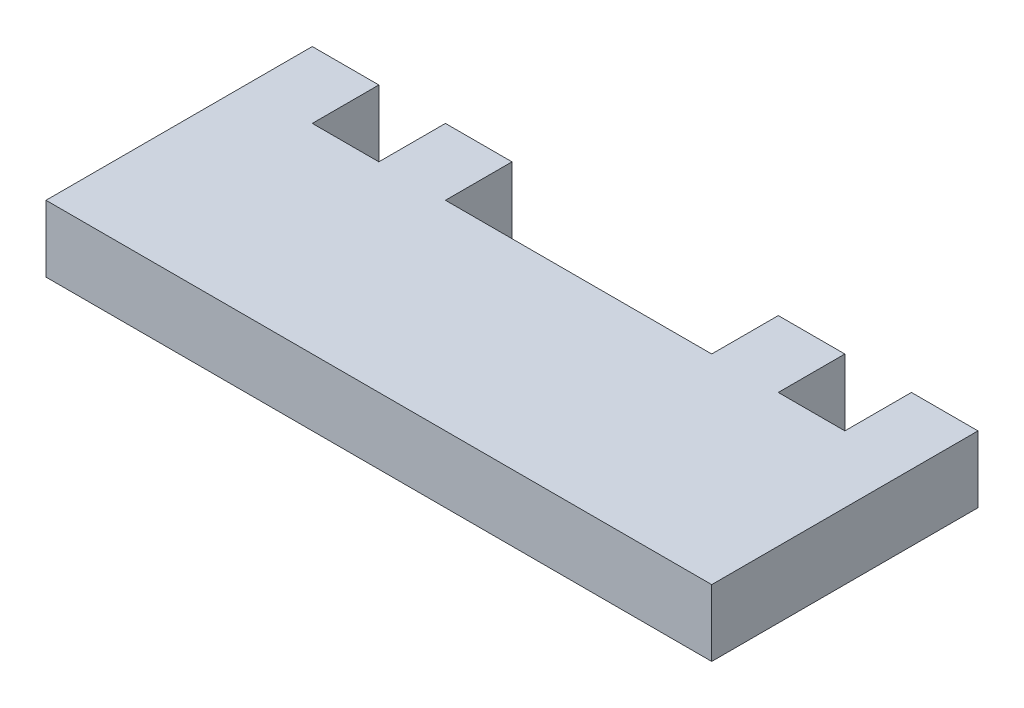
from build123d import *

# Parameters (mm, degrees)
SKETCH1_W           = 6.35
SKETCH1_H           = 6.35
BOSS_EXTRUDE1_DEPTH = 6.35


with BuildPart() as part:
    # Sketch1 → Boss-Extrude1 (new body)
    with BuildSketch(Plane(origin=(0, 0, 0), x_dir=(1, 0, 0), z_dir=(0, 1, 0))):
        Polygon((-31.75, 12.7), (-31.75, -12.7), (31.75, -12.7), (31.75, 12.7), (25.4, 12.7), (25.4, 6.35), (19.05, 6.35), (12.7, 6.35), (-12.7, 6.35), (-19.05, 6.35), (-25.4, 6.35), (-25.4, 12.7), align=None)
        with Locations((-15.875, 9.525)):
            Rectangle(SKETCH1_W, SKETCH1_H)
        with Locations((15.875, 9.525)):
            Rectangle(SKETCH1_W, SKETCH1_H)
    extrude(amount=BOSS_EXTRUDE1_DEPTH)


solid = part.part
